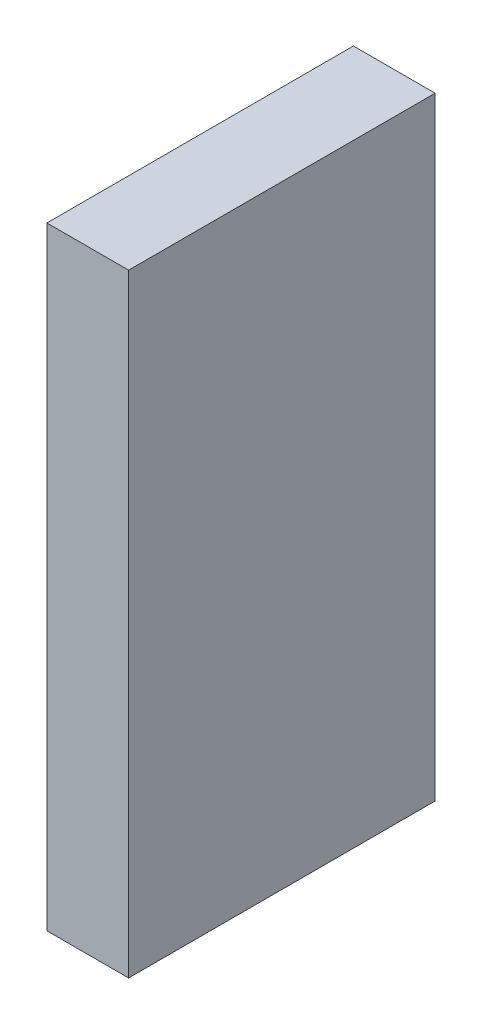
from build123d import *

# Parameters (mm, degrees)
SKETCH_1_W      = 15
SKETCH_1_H      = 30
EXTRUDE_1_DEPTH = 4


with BuildPart() as part:
    # Эскиз1 → Бобышка-Вытянуть1 (new body)
    with BuildSketch(Plane(origin=(0, 0, 0), x_dir=(0, 0, -1), z_dir=(1, 0, 0))):
        with Locations((-65.2494152, 39.53043122)):
            Rectangle(SKETCH_1_W, SKETCH_1_H)
    extrude(amount=EXTRUDE_1_DEPTH)


solid = part.part
